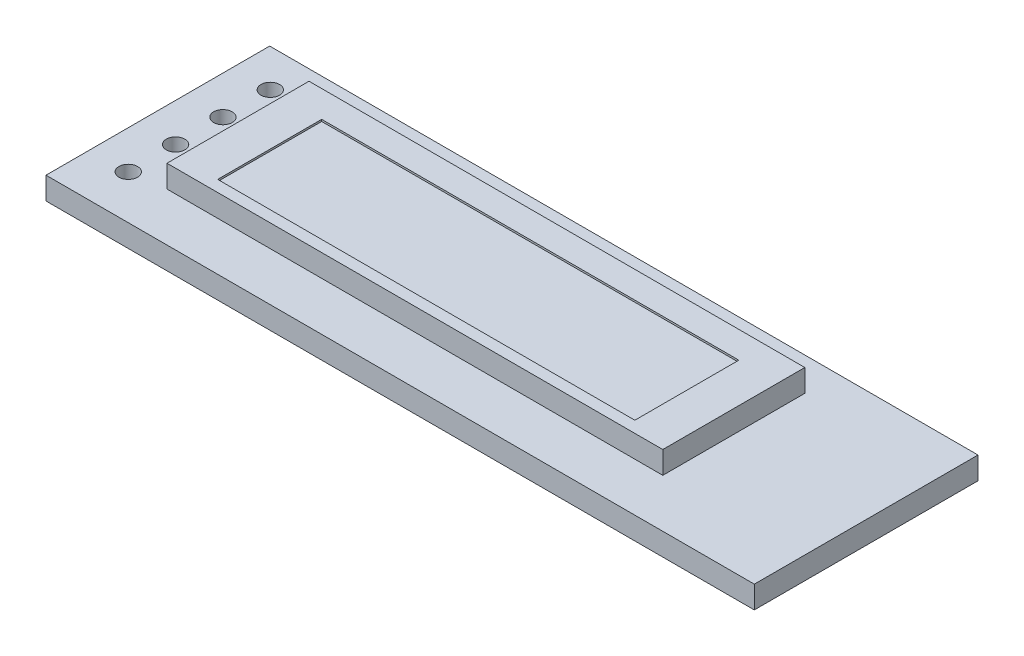
from build123d import *

# Parameters (mm, degrees)
SKETCH1_W           = 38
SKETCH1_H           = 12
BOSS_EXTRUDE1_DEPTH = 1.2
SKETCH2_W           = 26.6
SKETCH2_H           = 7.62
BOSS_EXTRUDE2_DEPTH = 1.2
SKETCH3_W           = 22.38
SKETCH3_H           = 5.58
CUT_EXTRUDE1_DEPTH  = 0.1
SKETCH4_R           = 0.5
CUT_EXTRUDE2_DEPTH  = 20.960961901


with BuildPart() as part:
    # Sketch1 → Boss-Extrude1 (new body)
    with BuildSketch(Plane(origin=(0, 0, 0), x_dir=(1, 0, 0), z_dir=(0, 1, 0))):
        Rectangle(SKETCH1_W, SKETCH1_H)
    extrude(amount=BOSS_EXTRUDE1_DEPTH)

    # Sketch2 → Boss-Extrude2 (add)
    with BuildSketch(Plane(origin=(0, 1.2, 0), x_dir=(1, 0, 0), z_dir=(0, 1, 0))):
        with Locations((-1.81, 0.41)):
            Rectangle(SKETCH2_W, SKETCH2_H)
    extrude(amount=BOSS_EXTRUDE2_DEPTH)

    # Sketch3 → Cut-Extrude1 (cut)
    with BuildSketch(Plane(origin=(0, 2.4, 0), x_dir=(1, 0, 0), z_dir=(0, 1, 0))):
        with Locations((-1.81, 0)):
            Rectangle(SKETCH3_W, SKETCH3_H)
    extrude(amount=-CUT_EXTRUDE1_DEPTH, mode=Mode.SUBTRACT)

    # Sketch4 → Cut-Extrude2 (cut, through all)
    with BuildSketch(Plane(origin=(0, 1.2, 0), x_dir=(1, 0, 0), z_dir=(0, 1, 0))):
        with Locations(Location((-16.948688295, 3.981018796, 0), (0, 0, 270))):
            Circle(SKETCH4_R)
        with Locations(Location((-16.948688295, 1.441018796, 0), (0, 0, 270))):
            Circle(SKETCH4_R)
        with Locations(Location((-16.948688295, -1.098981204, 0), (0, 0, 270))):
            Circle(SKETCH4_R)
        with Locations(Location((-16.948688295, -3.638981204, 0), (0, 0, 270))):
            Circle(SKETCH4_R)
    extrude(amount=-CUT_EXTRUDE2_DEPTH, mode=Mode.SUBTRACT)


solid = part.part
